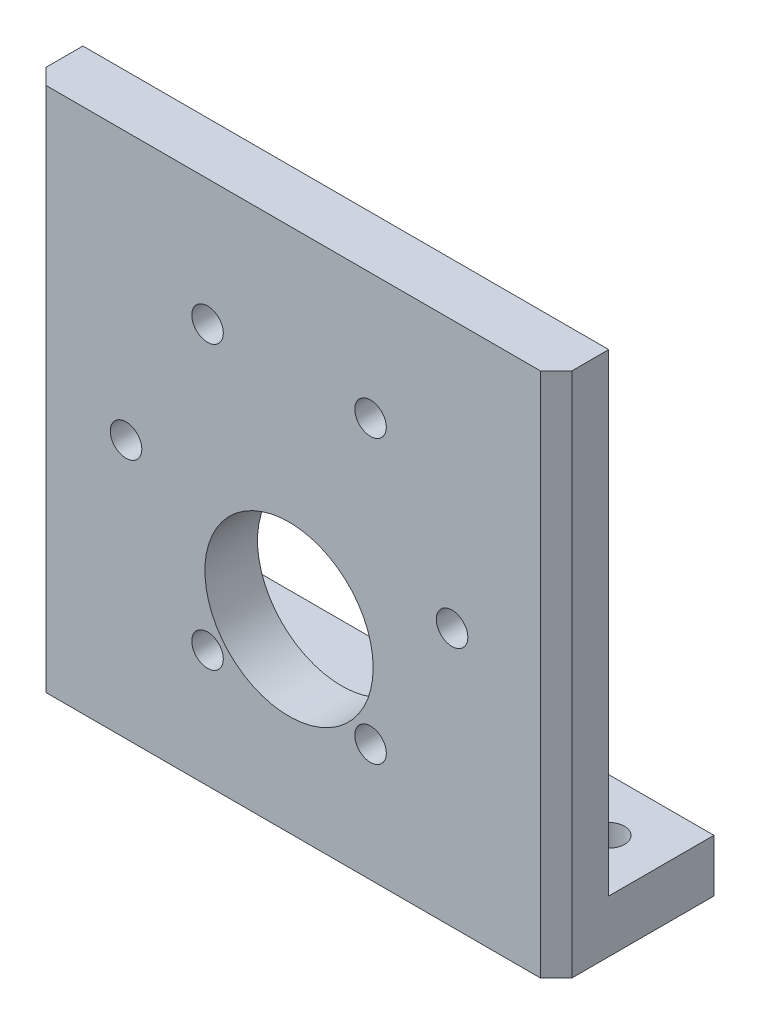
from build123d import *

# Parameters (mm, degrees)
SKETCH2_W           = 50
SKETCH2_H           = 50
SKETCH2_R           = 8
SKETCH2_R_2         = 1.5
BOSS_EXTRUDE1_DEPTH = 5
SKETCH5_W           = 50
SKETCH5_H           = 5
BOSS_EXTRUDE2_DEPTH = 10
SKETCH6_R           = 1.5
CUT_EXTRUDE2_DEPTH  = 10
CHAMFER1_SIZE       = 1.5


with BuildPart() as part:
    # Sketch2 → Boss-Extrude1 (new body)
    with BuildSketch(Plane.XY):
        with Locations((0.61173319, 0.711954255)):
            Rectangle(SKETCH2_W, SKETCH2_H)
        with Locations((0.21173319, -6.688045745)):
            Circle(SKETCH2_R, mode=Mode.SUBTRACT)
        with Locations((-7.53826681, 13.735348013)):
            Circle(SKETCH2_R_2, mode=Mode.SUBTRACT)
        with Locations((7.96173319, 13.735348013)):
            Circle(SKETCH2_R_2, mode=Mode.SUBTRACT)
        with Locations((-15.28826681, 0.311954255)):
            Circle(SKETCH2_R_2, mode=Mode.SUBTRACT)
        with Locations((-7.53826681, -13.111439504)):
            Circle(SKETCH2_R_2, mode=Mode.SUBTRACT)
        with Locations((7.96173319, -13.111439504)):
            Circle(SKETCH2_R_2, mode=Mode.SUBTRACT)
        with Locations((15.71173319, 0.311954255)):
            Circle(SKETCH2_R_2, mode=Mode.SUBTRACT)
    extrude(amount=BOSS_EXTRUDE1_DEPTH)

    # Sketch5 → Boss-Extrude2 (add)
    with BuildSketch(Plane(origin=(0, 0, 0), x_dir=(-1, 0, 0), z_dir=(0, 0, -1))):
        with Locations((-0.61173319, -21.788045745)):
            Rectangle(SKETCH5_W, SKETCH5_H)
    extrude(amount=BOSS_EXTRUDE2_DEPTH)

    # Sketch6 → Cut-Extrude2 (cut)
    with BuildSketch(Plane.XZ.offset(24.288045745)):
        with Locations(Location((-19.38826681, -5, 0), (0, 0, 270))):
            Circle(SKETCH6_R)
        with Locations(Location((20.61173319, -5, 0), (0, 0, 270))):
            Circle(SKETCH6_R)
    extrude(amount=-CUT_EXTRUDE2_DEPTH, mode=Mode.SUBTRACT)

    # Chamfer1
    chamfer1_edges = [part.edges().sort_by_distance(p)[0] for p in [
        (-24.38826681, 0.711954255, 5),
        (25.61173319, 0.711954255, 5),
    ]]
    chamfer(chamfer1_edges, length=CHAMFER1_SIZE)


solid = part.part
